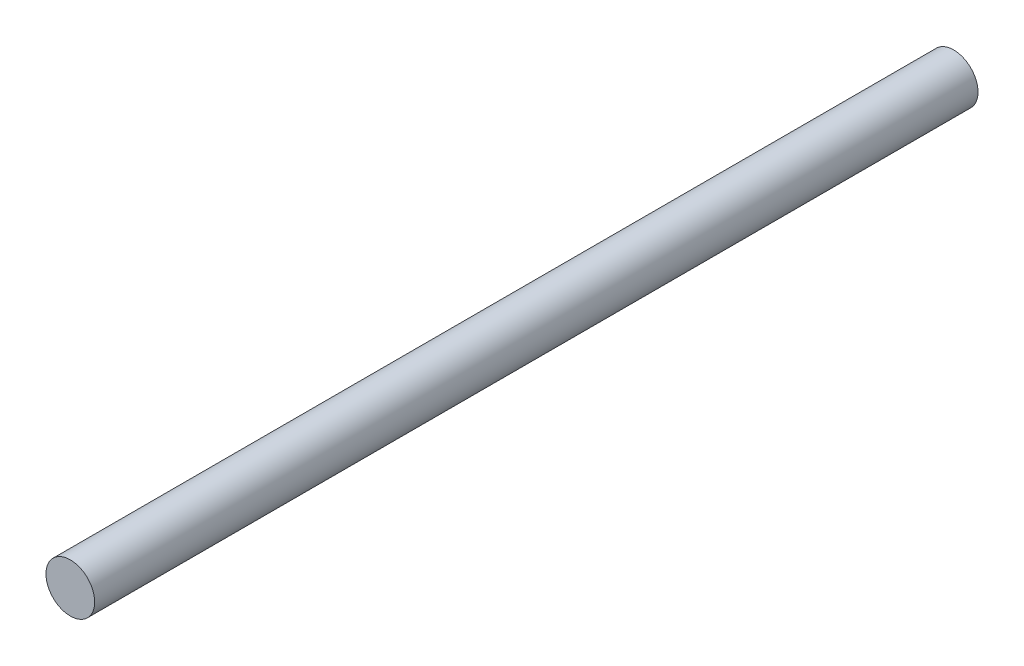
from build123d import *

# Parameters (mm, degrees)
SKETCH1_R           = 4
BOSS_EXTRUDE1_DEPTH = 145


with BuildPart() as part:
    # Sketch1 → Boss-Extrude1 (new body)
    with BuildSketch(Plane.XY):
        Circle(SKETCH1_R)
    extrude(amount=BOSS_EXTRUDE1_DEPTH)


solid = part.part
